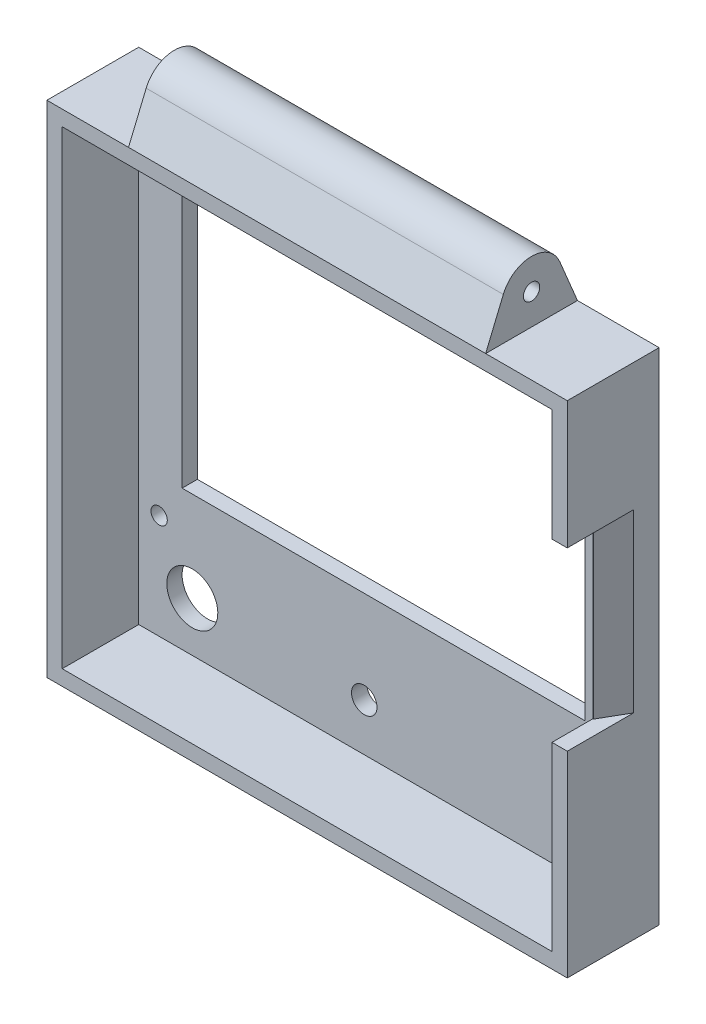
from build123d import *

# Parameters (mm, degrees)
ESBO_O2_W                = 18
ESBO_O2_H                = 98
RESSALTO_EXTRUS_O1_DEPTH = 51
CASCA1_T                 = -3
ESBO_O4_R                = 1.6
ESBO_O4_R_2              = 5
ESBO_O4_R_3              = 3
ESBO_O4_R_4              = 2.5
ESBO_O4_W                = 79
ESBO_O4_H                = 51.6
CORTE_EXTRUS_O1_DEPTH    = 3
ESBO_O5_R                = 1.6
RESSALTO_EXTRUS_O2_DEPTH = 102
ESBO_O6_W                = 16
ESBO_O6_H                = 12
CORTE_EXTRUS_O2_DEPTH    = 123.576506721
ESBO_O7_W                = 8
ESBO_O7_H                = 34.5
CORTE_EXTRUS_O3_DEPTH    = 10
CHANFRO1_SIZE            = 5
CHANFRO1_SIZE2           = 2.886751346


with BuildPart() as part:
    # Esboço2 → Ressalto-extrusão1 (new, symmetric)
    with BuildSketch(Plane(origin=(0, 0, 0), x_dir=(0, 0, -1), z_dir=(1, 0, 0))):
        with Locations((9, 49)):
            Rectangle(ESBO_O2_W, ESBO_O2_H)
    extrude(amount=RESSALTO_EXTRUS_O1_DEPTH, both=True)

    # Casca1
    casca1_openings = [part.faces().sort_by_distance(p)[0] for p in [
        (0, 49, 0),
    ]]
    offset(amount=CASCA1_T, openings=casca1_openings, kind=Kind.INTERSECTION)

    # Esboço4 → Corte-extrusão1 (cut)
    with BuildSketch(Plane(origin=(0, 0, -18), x_dir=(1, 0, 0), z_dir=(0, 0, -1))):
        with Locations(Location((-44, -23.5, 0), (0, 0, 180))):
            Circle(ESBO_O4_R)
        with Locations(Location((-44, -88.5, 0), (0, 0, 180))):
            Circle(ESBO_O4_R)
        with Locations(Location((44, -88.5, 0), (0, 0, 180))):
            Circle(ESBO_O4_R)
        with Locations(Location((44, -23.5, 0), (0, 0, 180))):
            Circle(ESBO_O4_R)
        with Locations(Location((-37.5, -12.7, 0), (0, 0, 180))):
            Circle(ESBO_O4_R_2)
        with Locations(Location((36.75, -15.3, 0), (0, 0, 180))):
            Circle(ESBO_O4_R_3)
        with Locations(Location((-3.8, -12.3, 0), (0, 0, 180))):
            Circle(ESBO_O4_R_4)
        with Locations((0, -56.2)):
            Rectangle(ESBO_O4_W, ESBO_O4_H)
    extrude(amount=-CORTE_EXTRUS_O1_DEPTH, mode=Mode.SUBTRACT)

    # Esboço5 → Ressalto-extrusão2 (add, through all)
    with BuildSketch(Plane(origin=(51, 0, 0), x_dir=(0, 0, -1), z_dir=(1, 0, 0))):
        with BuildLine():
            Line((14.538461538, 106.307692308), (18, 98))
            Line((18, 98), (0, 98))
            Line((0, 98), (3.461538462, 106.307692308))
            ThreePointArc((3.461538462, 106.307692308), (9, 110), (14.538461538, 106.307692308))
        make_face()
        with Locations((9, 104)):
            Circle(ESBO_O5_R, mode=Mode.SUBTRACT)
    extrude(amount=-RESSALTO_EXTRUS_O2_DEPTH)

    # Esboço6 → Corte-extrusão2 (cut, through all)
    with BuildSketch(Plane(origin=(0, 0, -18), x_dir=(-1, 0, 0), z_dir=(0, 0, -1))):
        with Locations((-43, 104)):
            Rectangle(ESBO_O6_W, ESBO_O6_H)
        with Locations((43, 104)):
            Rectangle(ESBO_O6_W, ESBO_O6_H)
    extrude(amount=-CORTE_EXTRUS_O2_DEPTH, mode=Mode.SUBTRACT)

    # Esboço7 → Corte-extrusão3 (cut)
    with BuildSketch(Plane(origin=(51, 0, 0), x_dir=(0, 0, -1), z_dir=(1, 0, 0))):
        with Locations((4, 55.75)):
            Rectangle(ESBO_O7_W, ESBO_O7_H)
    extrude(amount=-CORTE_EXTRUS_O3_DEPTH, mode=Mode.SUBTRACT)

    # Chanfro1
    chanfro1_edges = [part.edges().sort_by_distance(p)[0] for p in [
        (51, 55.75, -8),
    ]]
    chanfro1_side = [part.faces().sort_by_distance(p)[0] for p in [
        (51, 47.747983871, -9.927419355),
    ]]
    chamfer(chanfro1_edges, length=CHANFRO1_SIZE, length2=CHANFRO1_SIZE2, reference=chanfro1_side[0])


solid = part.part
